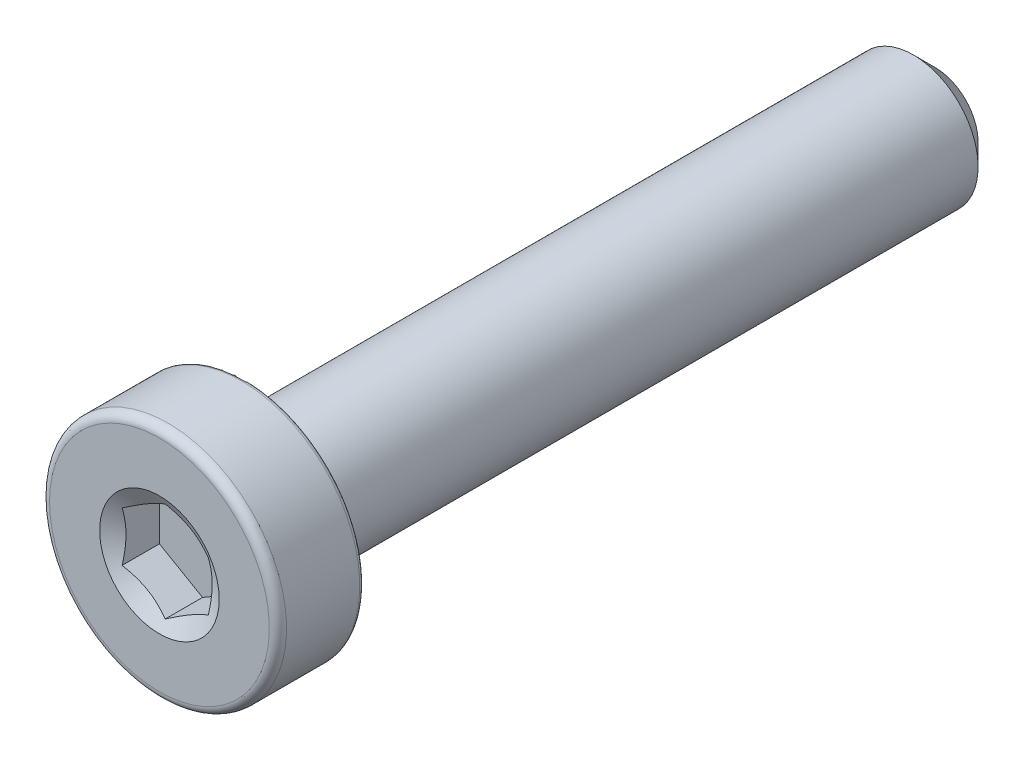
from build123d import *

# Parameters (mm, degrees)
CUT_EXTRUDE1_START = 9
CUT_EXTRUDE1_DEPTH = 1


with BuildPart() as part:
    # Sketch2 → Revolve1 (revolve)
    with BuildSketch(Plane(origin=(0, 0, 0), x_dir=(0, 0, -1), z_dir=(1, 0, 0)), mode=Mode.PRIVATE) as revolve1_sk:
        with BuildLine():
            Line((9, 0), (9, 1))
            Line((9, 1), (8.5, 1.5))
            Line((8.5, 1.5), (-7, 1.5))
            Line((-7, 1.5), (-7, 2.65))
            ThreePointArc((-7, 2.65), (-7.029289322, 2.720710678), (-7.1, 2.75))
            Line((-7.1, 2.75), (-8.8, 2.75))
            ThreePointArc((-8.8, 2.75), (-8.941421356, 2.691421356), (-9, 2.55))
            Line((-9, 2.55), (-9, 0))
            Line((-9, 0), (9, 0))
        make_face()
    revolve(revolve1_sk.sketch.rotate(Axis((0, 0, -9), (0, 0, 1)), 90), axis=Axis((0, 0, -9), (0, 0, 1)))

    # Sketch3 → Cut-Extrude1 (cut)
    with BuildSketch(Plane.XY.offset(CUT_EXTRUDE1_START)):
        Polygon((-1, 0.577350269), (-1, -0.577350269), (0, -1.154700538), (1, -0.577350269), (1, 0.577350269), (0, 1.154700538), align=None)
    extrude(amount=-CUT_EXTRUDE1_DEPTH, mode=Mode.SUBTRACT)

    # Cut-Extrude2 cone 1 section (through the dimple's axis) → Cut-Extrude2 (revolve, cut)
    with BuildSketch(Plane(origin=(0, 0, 9), x_dir=(0, -1, 0), z_dir=(1, 0, 0))):
        Polygon((0, 0), (1.387250449, 0), (0, 0.80092942), align=None)
    revolve(axis=Axis((0, 0, 9), (0, 0, -1)), mode=Mode.SUBTRACT)


solid = part.part
